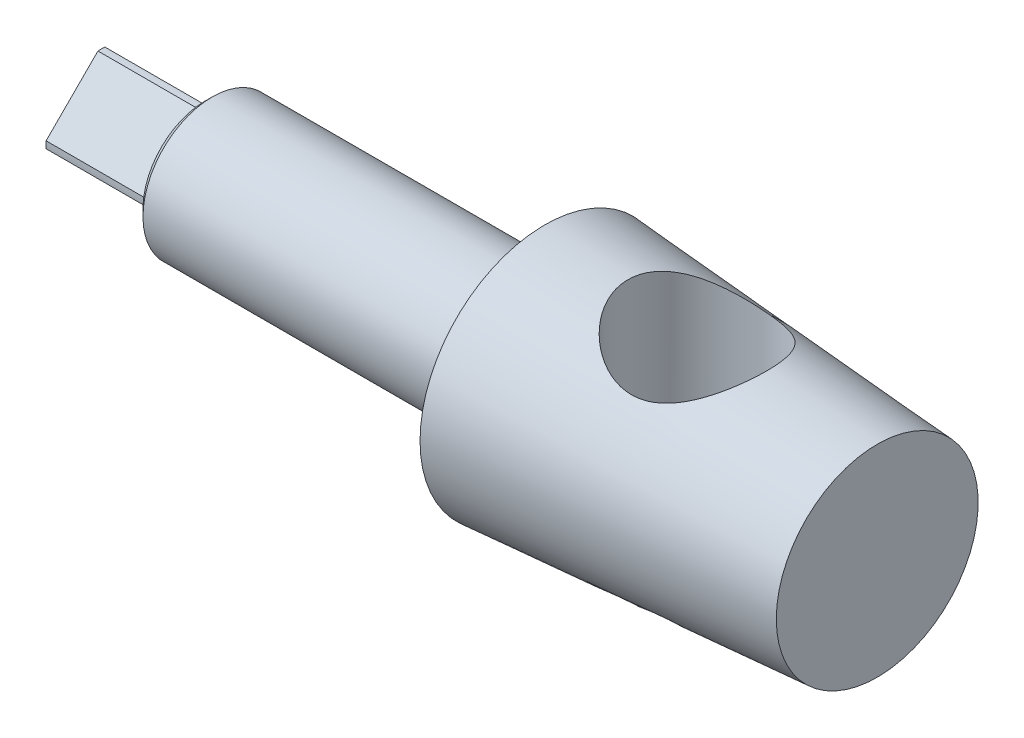
from build123d import *

# Parameters (mm, degrees)
CUT_EXTRUDE_1_DEPTH      = 69.876701431
CUT_EXTRUDE_1_DEPTH_BACK = 69.876701431
SKETCH_2_R               = 10
SKETCH_3_OUTSIDE_W       = 62.606
SKETCH_3_OUTSIDE_H       = 62.606
CUT_EXTRUDE_2_DEPTH      = 15
CHAMFER_1_SIZE           = 1


with BuildPart() as part:
    # 草图1 → 旋转1 (revolve)
    with BuildSketch(Plane.XY, mode=Mode.PRIVATE) as revolve_1_sk:
        Polygon((-64, 0), (-64, 8), (-49, 8), (-49, 10), (0, 10), (0, 18), (48, 14.571428571), (48, 0), align=None)
    revolve(revolve_1_sk.sketch.rotate(Axis((-69.993580533, 0, 0), (1, 0, 0)), 90), axis=Axis((-69.993580533, 0, 0), (1, 0, 0)))

    # 草图2 → 拉伸1 (cut, two sides: drawn at the far end of the back side and taken through both)
    with BuildSketch(Plane(origin=(0, 0, 0), x_dir=(1, 0, 0), z_dir=(0, 1, 0)).offset(-CUT_EXTRUDE_1_DEPTH_BACK)):
        with Locations(Location((22, 0, 0), (0, 0, 132.082422816))):
            Circle(SKETCH_2_R)
    extrude(amount=CUT_EXTRUDE_1_DEPTH + CUT_EXTRUDE_1_DEPTH_BACK, mode=Mode.SUBTRACT)

    # 草图3 outside → 拉伸2 (cut)
    with BuildSketch(Plane.ZY.offset(64)):
        Rectangle(SKETCH_3_OUTSIDE_W, SKETCH_3_OUTSIDE_H)
        Polygon((-8.485281374, 0), (0, -8.485281374), (8.485281374, 0), (0, 8.485281374), align=None, mode=Mode.SUBTRACT)
    extrude(amount=-CUT_EXTRUDE_2_DEPTH, mode=Mode.SUBTRACT)

    # 倒角1
    chamfer_1_edges = [part.edges().sort_by_distance(p)[0] for p in [
        (-49, 0, -10),
    ]]
    chamfer(chamfer_1_edges, length=CHAMFER_1_SIZE)


solid = part.part
